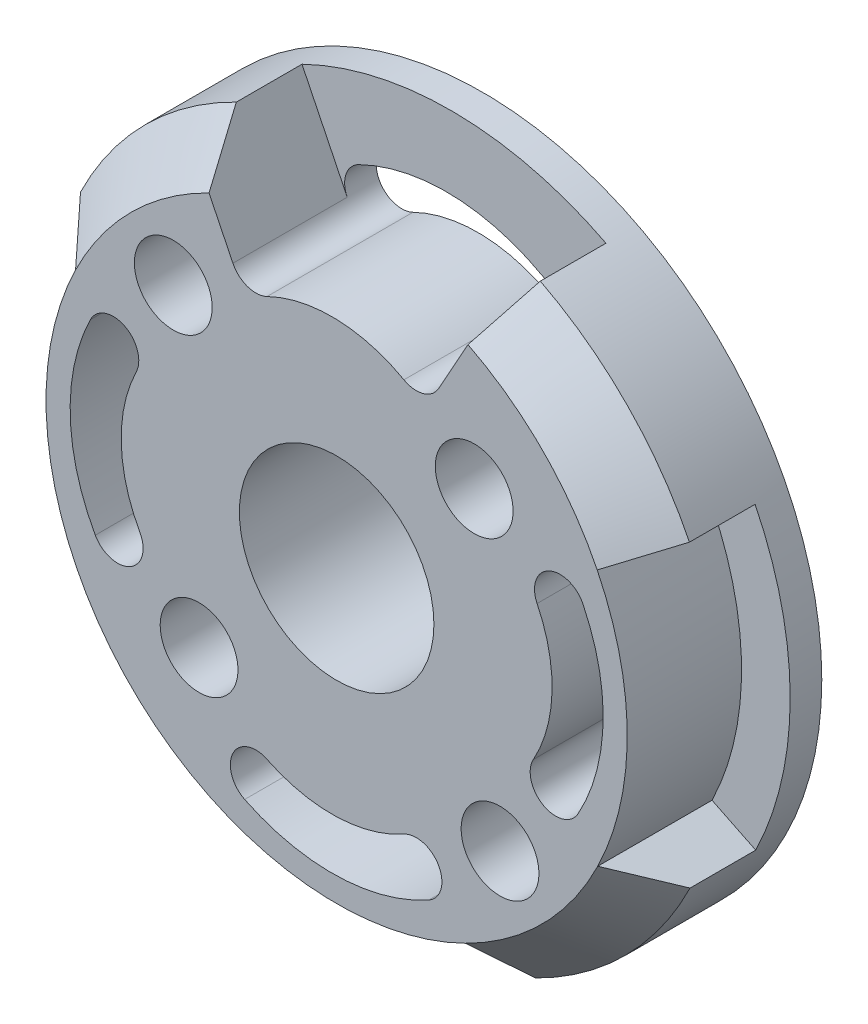
from build123d import *

# Parameters (mm, degrees)
IZIM1_R                     = 13.95
IZIM1_R_2                   = 4
Y_KSEKLIK_EKSTR_ZYON3_DEPTH = 6
M3_BO_LUKLU_DELIK3_D        = 3.2
KES_EKSTR_ZYON2_DEPTH       = 6
DAIRESEL_KAPLAMA1_COUNT     = 2
DAIRESEL_KAPLAMA1_ANGLE     = 90
KES_EKSTR_ZYON11_DEPTH      = 4.7
PAH1_SIZE                   = 2
KES_EKSTR_ZYON12_START      = -4.7
KES_EKSTR_ZYON12_DEPTH      = 4.7
DAIRESEL_KAPLAMA2_COUNT     = 3
DAIRESEL_KAPLAMA2_ANGLE     = 180


with BuildPart() as part:
    # Çizim1 → Yükseklik-Ekstrüzyon3 (new body)
    with BuildSketch(Plane.XY):
        Circle(IZIM1_R)
        Circle(IZIM1_R_2, mode=Mode.SUBTRACT)
    extrude(amount=Y_KSEKLIK_EKSTR_ZYON3_DEPTH)

    # M3 Boşluklu Delik3 (through all)
    with Locations(Plane(origin=(0, 0, 0), x_dir=(-1, 0, 0), z_dir=(0, 0, -1))):
        with Locations((-5.656854249, 5.656854249), (-6.717514421, -6.717514421), (5.656854249, -5.656854249), (6.717514421, 6.717514421)):
            Hole(M3_BO_LUKLU_DELIK3_D / 2)

    # Çizim13 → Kes-Ekstrüzyon2 (cut)
    with BuildSketch(Plane.XY.offset(6)):
        with BuildLine():
            ThreePointArc((-10.129468154, 3.782692346), (-10.95644466, -0.028335886), (-9.925054528, -3.789194927))
            ThreePointArc((-9.925054528, -3.789194927), (-8.496760909, -4.195368951), (-8.090586885, -2.767075332))
            ThreePointArc((-8.090586885, -2.767075332), (-8.857209488, 0.028335886), (-8.242525614, 2.861037394))
            ThreePointArc((-8.242525614, 2.861037394), (-8.725169408, 4.26533614), (-10.129468154, 3.782692346))
        make_face()
        with BuildLine():
            ThreePointArc((10.129468154, 3.782692346), (10.95644466, -0.028335886), (9.925054528, -3.789194927))
            ThreePointArc((9.925054528, -3.789194927), (8.496760909, -4.195368951), (8.090586885, -2.767075332))
            ThreePointArc((8.090586885, -2.767075332), (8.857209488, 0.028335886), (8.242525614, 2.861037394))
            ThreePointArc((8.242525614, 2.861037394), (8.725169408, 4.26533614), (10.129468154, 3.782692346))
        make_face()
    kes_ekstr_zyon2 = extrude(amount=-KES_EKSTR_ZYON2_DEPTH, mode=Mode.SUBTRACT)

    # Dairesel Kaplama1: Kes-Ekstrüzyon2 ×2 about axis
    dairesel_kaplama1_axis = Axis((0, 0, 0), (0, 0, 1))
    for i in range(1, DAIRESEL_KAPLAMA1_COUNT):
        add(kes_ekstr_zyon2.rotate(dairesel_kaplama1_axis, i * DAIRESEL_KAPLAMA1_ANGLE / (DAIRESEL_KAPLAMA1_COUNT - 1)), mode=Mode.SUBTRACT)

    # Çizim16 → Kes-Ekstrüzyon11 (cut)
    with BuildSketch(Plane.XY.offset(6)):
        with BuildLine():
            Line((-6.125352388, 12.533258081), (-4.26533614, 8.725169408))
            ThreePointArc((-4.26533614, 8.725169408), (-4.314854036, 9.527277584), (-3.782692346, 10.129468154))
            ThreePointArc((-3.782692346, 10.129468154), (0.028335886, 10.95644466), (3.789194927, 9.925054528))
            ThreePointArc((3.789194927, 9.925054528), (4.288091233, 9.295029113), (4.195368951, 8.496760909))
            Line((4.195368951, 8.496760909), (6.374759269, 12.408261129))
            ThreePointArc((6.374759269, 12.408261129), (0.139488378, 13.949302599), (-6.125352388, 12.533258081))
        make_face()
    extrude(amount=-KES_EKSTR_ZYON11_DEPTH, mode=Mode.SUBTRACT)

    # Pah1
    pah1_edges = [part.edges().sort_by_distance(p)[0] for p in [
        (-7.387619176, -11.833240592, 6),
    ]]
    chamfer(pah1_edges, length=PAH1_SIZE)

    # Çizim18 → Kes-Ekstrüzyon12 (cut)
    with BuildSketch(Plane.XY.offset(6).offset(KES_EKSTR_ZYON12_START)):
        with BuildLine():
            Line((-10.735839815, 5.248260994), (-12.53263309, 6.126631034))
            ThreePointArc((-12.53263309, 6.126631034), (-13.94997085, -0.028518286), (-12.50747878, -6.177821183))
            Line((-12.50747878, -6.177821183), (-10.714291858, -5.292112053))
            ThreePointArc((-10.714291858, -5.292112053), (-11.949975029, -0.024429643), (-10.735839815, 5.248260994))
        make_face()
    kes_ekstr_zyon12 = extrude(amount=KES_EKSTR_ZYON12_DEPTH, mode=Mode.SUBTRACT)

    # Dairesel Kaplama2: Kes-Ekstrüzyon12 ×3 about axis
    dairesel_kaplama2_axis = Axis((0, 0, 6), (0, 0, 1))
    for i in range(1, DAIRESEL_KAPLAMA2_COUNT):
        add(kes_ekstr_zyon12.rotate(dairesel_kaplama2_axis, i * DAIRESEL_KAPLAMA2_ANGLE / (DAIRESEL_KAPLAMA2_COUNT - 1)), mode=Mode.SUBTRACT)


solid = part.part
